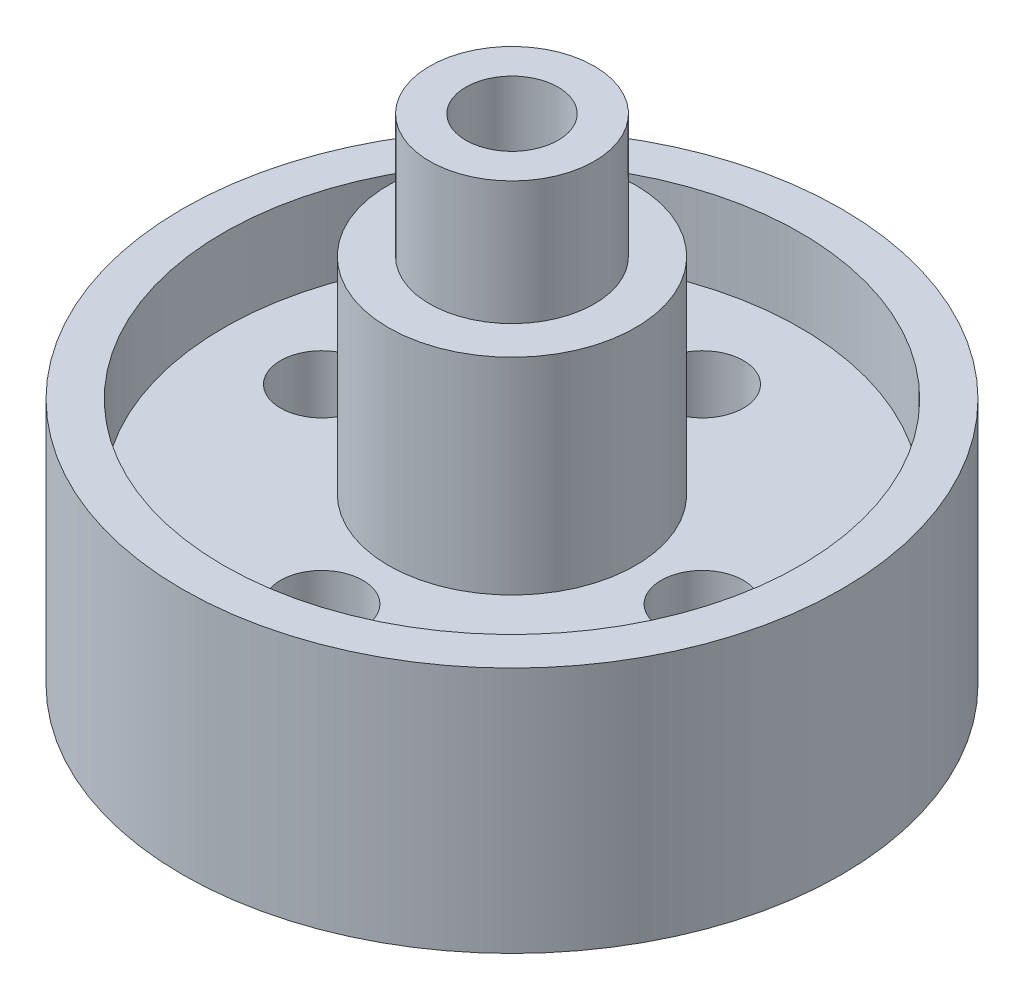
from build123d import *

# Parameters (mm, degrees)
SKETCH1_R           = 50.8
BOSS_EXTRUDE2_DEPTH = 38.1
SKETCH2_R           = 44.45
CUT_EXTRUDE1_DEPTH  = 12.7
SKETCH3_R           = 19.05
BOSS_EXTRUDE3_DEPTH = 31.75
SKETCH4_R           = 12.7
BOSS_EXTRUDE4_DEPTH = 19.05
SKETCH5_R           = 7.112
CUT_EXTRUDE2_DEPTH  = 105.726882891
SKETCH6_R           = 6.35
CUT_EXTRUDE3_DEPTH  = 88.988181024


with BuildPart() as part:
    # Sketch1 → Boss-Extrude2 (new body)
    with BuildSketch(Plane(origin=(0, 0, 0), x_dir=(1, 0, 0), z_dir=(0, 1, 0))):
        with Locations(Location((0, 0, 0), (0, 0, 90))):
            Circle(SKETCH1_R)
    extrude(amount=BOSS_EXTRUDE2_DEPTH)

    # Sketch2 → Cut-Extrude1 (cut)
    with BuildSketch(Plane(origin=(0, 38.1, 0), x_dir=(1, 0, 0), z_dir=(0, 1, 0))):
        with Locations(Location((0, 0, 0), (0, 0, 270))):
            Circle(SKETCH2_R)
    extrude(amount=-CUT_EXTRUDE1_DEPTH, mode=Mode.SUBTRACT)

    # Sketch3 → Boss-Extrude3 (add)
    with BuildSketch(Plane(origin=(0, 25.4, 0), x_dir=(1, 0, 0), z_dir=(0, 1, 0))):
        with Locations(Location((0, 0, 0), (0, 0, 270))):
            Circle(SKETCH3_R)
    extrude(amount=BOSS_EXTRUDE3_DEPTH)

    # Sketch4 → Boss-Extrude4 (add)
    with BuildSketch(Plane(origin=(0, 57.15, 0), x_dir=(1, 0, 0), z_dir=(0, 1, 0))):
        with Locations(Location((0, 0, 0), (0, 0, 90))):
            Circle(SKETCH4_R)
    extrude(amount=BOSS_EXTRUDE4_DEPTH)

    # Sketch5 → Cut-Extrude2 (cut, through all)
    with BuildSketch(Plane(origin=(0, 76.2, 0), x_dir=(1, 0, 0), z_dir=(0, 1, 0))):
        with Locations(Location((0, 0, 0), (0, 0, 270))):
            Circle(SKETCH5_R)
    extrude(amount=-CUT_EXTRUDE2_DEPTH, mode=Mode.SUBTRACT)

    # Sketch6 → Cut-Extrude3 (cut, through all)
    with BuildSketch(Plane(origin=(0, 25.4, 0), x_dir=(1, 0, 0), z_dir=(0, 1, 0))):
        with Locations(Location((0, -29.337, 0), (0, 0, 270))):
            Circle(SKETCH6_R)
        with Locations(Location((-29.337, 0, 0), (0, 0, 270))):
            Circle(SKETCH6_R)
        with Locations(Location((0, 29.337, 0), (0, 0, 270))):
            Circle(SKETCH6_R)
        with Locations(Location((29.337, 0, 0), (0, 0, 270))):
            Circle(SKETCH6_R)
    extrude(amount=-CUT_EXTRUDE3_DEPTH, mode=Mode.SUBTRACT)


solid = part.part
